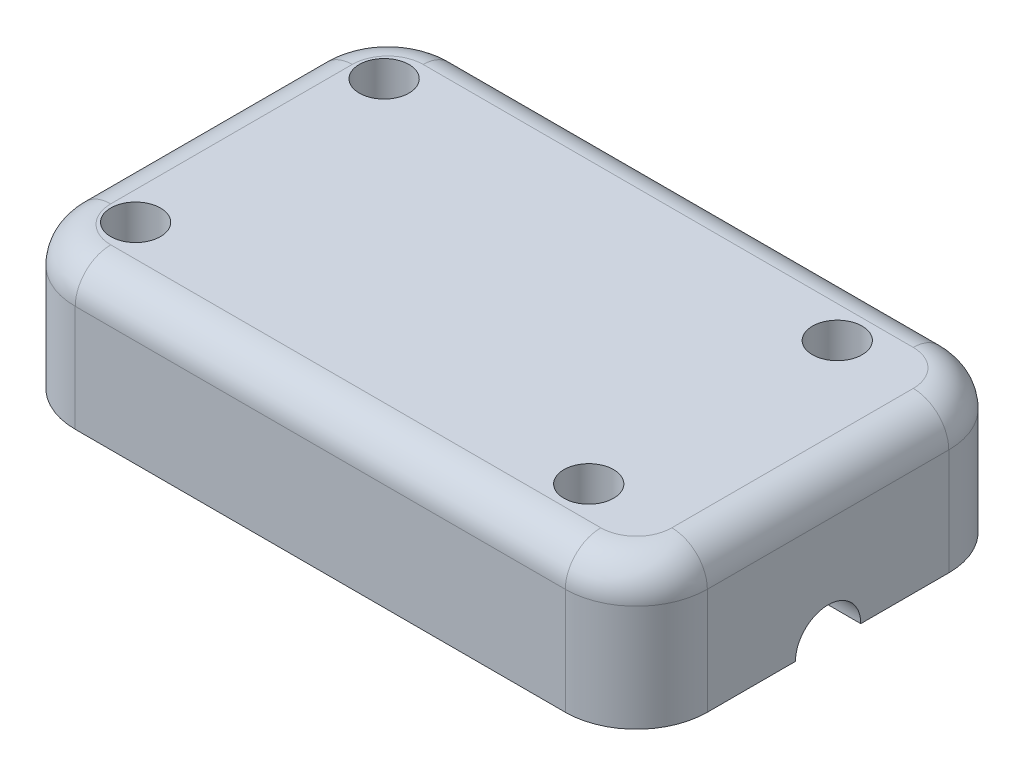
from build123d import *

# Parameters (mm, degrees)
BOSS_EXTRUDE1_DEPTH  = 5
SKETCH3_W            = 89.015633911
SKETCH3_H            = 54
SKETCH3_R            = 1.75
BOSS_EXTRUDE2_DEPTH  = 10
SKETCH4_W            = 5
SKETCH4_H            = 20
SKETCH4_W_2          = 84.015633911
BOSS_EXTRUDE3_DEPTH  = 5
SKETCH5_W            = 84.015633911
SKETCH5_H            = 20
SKETCH5_W_2          = 5
BOSS_EXTRUDE4_DEPTH  = 5
SKETCH6_W            = 5
SKETCH6_H            = 20
BOSS_EXTRUDE5_DEPTH  = 5
SKETCH7_W            = 5
SKETCH7_H            = 20
BOSS_EXTRUDE6_DEPTH  = 5
SKETCH8_W            = 5
SKETCH8_H            = 44
BOSS_EXTRUDE7_DEPTH  = 20
SKETCH11_W           = 89.015633911
SKETCH11_H           = 54
CUT_EXTRUDE2_DEPTH   = 10
SKETCH12_R           = 1.75
BOSS_EXTRUDE8_DEPTH  = 17.5
SKETCH15_W           = 8
SKETCH15_H           = 3
CUT_EXTRUDE4_DEPTH   = 10
BOSS_EXTRUDE9_DEPTH  = 5
SKETCH18_W           = 41.02
SKETCH18_H           = 19.78
BOSS_EXTRUDE10_DEPTH = 2
SKETCH19_R           = 3.5
SKETCH19_R_2         = 1.75
CUT_EXTRUDE5_DEPTH   = 5
FILLET1_R            = 10
FILLET2_R            = 5
BOSS_EXTRUDE11_DEPTH = 12
SKETCH21_W           = 2.5
SKETCH21_H           = 12
BOSS_EXTRUDE12_DEPTH = 7
CUT_EXTRUDE6_DEPTH   = 3
CHAMFER1_SIZE        = 2


with BuildPart() as part:
    # Sketch1 → Boss-Extrude1 (new body)
    with BuildSketch(Plane(origin=(-2.183009885, 0, 0), x_dir=(0, 0, -1), z_dir=(1, 0, 0))):
        with BuildLine():
            Line((30.202901291, 42.056855501), (30.202901291, 27.775000784))
            Line((30.202901291, 27.775000784), (30.202901291, 26.275000784))
            Line((30.202901291, 26.275000784), (30.202901291, 25.275000784))
            Line((30.202901291, 25.275000784), (46.611342077, 25.275000784))
            ThreePointArc((46.611342077, 25.275000784), (51.211342077, 29.875000784), (55.811342077, 25.275000784))
            Line((55.811342077, 25.275000784), (72.202901291, 25.275000784))
            Line((72.202901291, 25.275000784), (72.202901291, 26.275000784))
            Line((72.202901291, 26.275000784), (72.202901291, 27.775000784))
            Line((72.202901291, 27.775000784), (72.202901291, 43.275000784))
            Line((72.202901291, 43.275000784), (72.202901291, 45.275000784))
            Line((72.202901291, 45.275000784), (30.202901291, 45.275000784))
            Line((30.202901291, 45.275000784), (30.202901291, 42.056855501))
        make_face()
    extrude(amount=BOSS_EXTRUDE1_DEPTH)

    # Sketch3 → Boss-Extrude2 (add)
    with BuildSketch(Plane(origin=(0, 45.275000784, 0), x_dir=(1, 0, 0), z_dir=(0, 1, 0))):
        with Locations((-41.690826841, 51.202901291)):
            Rectangle(SKETCH3_W, SKETCH3_H)
        with Locations(Location((-77.198643796, 33.702901291, 0), (0, 0, 270))):
            Circle(SKETCH3_R, mode=Mode.SUBTRACT)
        with Locations(Location((-13.383009885, 33.702901291, 0), (0, 0, 270))):
            Circle(SKETCH3_R, mode=Mode.SUBTRACT)
        with Locations(Location((-77.198643796, 68.702901291, 0), (0, 0, 270))):
            Circle(SKETCH3_R, mode=Mode.SUBTRACT)
        with Locations(Location((-13.383009885, 68.702901291, 0), (0, 0, 270))):
            Circle(SKETCH3_R, mode=Mode.SUBTRACT)
    extrude(amount=BOSS_EXTRUDE2_DEPTH)

    # Sketch4 → Boss-Extrude3 (add)
    with BuildSketch(Plane.XY.offset(-24.202901291)):
        with Locations((0.316990115, 35.275000784)):
            Rectangle(SKETCH4_W, SKETCH4_H)
        with Locations((-44.190826841, 35.275000784)):
            Rectangle(SKETCH4_W_2, SKETCH4_H)
    extrude(amount=-BOSS_EXTRUDE3_DEPTH)

    # Sketch5 → Boss-Extrude4 (add)
    with BuildSketch(Plane(origin=(0, 0, -78.202901291), x_dir=(-1, 0, 0), z_dir=(0, 0, -1))):
        with Locations((44.190826841, 35.275000784)):
            Rectangle(SKETCH5_W, SKETCH5_H)
        with Locations((-0.316990115, 35.275000784)):
            Rectangle(SKETCH5_W_2, SKETCH5_H)
    extrude(amount=-BOSS_EXTRUDE4_DEPTH)

    # Sketch6 → Boss-Extrude5 (add)
    with BuildSketch(Plane(origin=(0, 0, -72.202901291), x_dir=(-1, 0, 0), z_dir=(0, 0, -1))):
        with Locations((-0.316990115, 35.275000784)):
            Rectangle(SKETCH6_W, SKETCH6_H)
    extrude(amount=BOSS_EXTRUDE5_DEPTH)

    # Sketch7 → Boss-Extrude6 (add)
    with BuildSketch(Plane.XY.offset(-30.202901291)):
        with Locations((0.316990115, 35.275000784)):
            Rectangle(SKETCH7_W, SKETCH7_H)
    extrude(amount=BOSS_EXTRUDE6_DEPTH)

    # Sketch8 → Boss-Extrude7 (add)
    with BuildSketch(Plane.XZ.offset(-45.275000784)):
        with Locations((-83.698643796, -51.202901291)):
            Rectangle(SKETCH8_W, SKETCH8_H)
    extrude(amount=BOSS_EXTRUDE7_DEPTH)

    # Sketch11 → Cut-Extrude2 (cut)
    with BuildSketch(Plane(origin=(0, 55.275000784, 0), x_dir=(1, 0, 0), z_dir=(0, 1, 0))):
        with Locations((-41.690826841, 51.202901291)):
            Rectangle(SKETCH11_W, SKETCH11_H)
    extrude(amount=-CUT_EXTRUDE2_DEPTH, mode=Mode.SUBTRACT)

    # Sketch12 → Boss-Extrude8 (add)
    # profile 1 of 4: a face of its own
    with BuildSketch(Plane(origin=(0, 45.275000784, 0), x_dir=(1, 0, 0), z_dir=(0, 1, 0))):
        with BuildLine():
            ThreePointArc((-71.098643796, 33.702901291), (-74.667833649, 39.253126511), (-81.198643796, 38.308332867))
            Line((-81.198643796, 38.308332867), (-81.198643796, 29.202901291))
            Line((-81.198643796, 29.202901291), (-73.08039174, 29.202901291))
            ThreePointArc((-73.08039174, 29.202901291), (-71.616021762, 31.244379127), (-71.098643796, 33.702901291))
        make_face()
        with Locations(Location((-77.198643796, 33.702901291, 0), (0, 0, 270))):
            Circle(SKETCH12_R, mode=Mode.SUBTRACT)
    # profile 2 of 4: a face of its own
    with BuildSketch(Plane(origin=(0, 45.275000784, 0), x_dir=(1, 0, 0), z_dir=(0, 1, 0))):
        with BuildLine():
            ThreePointArc((-71.098643796, 68.702901291), (-71.616021762, 71.161423454), (-73.08039174, 73.202901291))
            Line((-73.08039174, 73.202901291), (-81.198643796, 73.202901291))
            Line((-81.198643796, 73.202901291), (-81.198643796, 64.097469715))
            ThreePointArc((-81.198643796, 64.097469715), (-74.667833649, 63.15267607), (-71.098643796, 68.702901291))
        make_face()
        with Locations(Location((-77.198643796, 68.702901291, 0), (0, 0, 270))):
            Circle(SKETCH12_R, mode=Mode.SUBTRACT)
    # profile 3 of 4: a face of its own
    with BuildSketch(Plane(origin=(0, 45.275000784, 0), x_dir=(1, 0, 0), z_dir=(0, 1, 0))):
        with BuildLine():
            ThreePointArc((-7.283009885, 33.702901291), (-15.841532049, 39.285523325), (-17.501261942, 29.202901291))
            Line((-17.501261942, 29.202901291), (-9.264757829, 29.202901291))
            ThreePointArc((-9.264757829, 29.202901291), (-7.800387851, 31.244379127), (-7.283009885, 33.702901291))
        make_face()
        with Locations(Location((-13.383009885, 33.702901291, 0), (0, 0, 270))):
            Circle(SKETCH12_R, mode=Mode.SUBTRACT)
    # profile 4 of 4: a face of its own
    with BuildSketch(Plane(origin=(0, 45.275000784, 0), x_dir=(1, 0, 0), z_dir=(0, 1, 0))):
        with BuildLine():
            ThreePointArc((-17.501261942, 73.202901291), (-15.841532049, 63.120279257), (-7.283009885, 68.702901291))
            ThreePointArc((-7.283009885, 68.702901291), (-7.800387851, 71.161423454), (-9.264757829, 73.202901291))
            Line((-9.264757829, 73.202901291), (-17.501261942, 73.202901291))
        make_face()
        with Locations(Location((-13.383009885, 68.702901291, 0), (0, 0, 270))):
            Circle(SKETCH12_R, mode=Mode.SUBTRACT)
    extrude(amount=-BOSS_EXTRUDE8_DEPTH)

    # Sketch15 → Cut-Extrude4 (cut)
    with BuildSketch(Plane.ZY.offset(86.198643796)):
        with Locations((-51.202901291, 26.775000784)):
            Rectangle(SKETCH15_W, SKETCH15_H)
    extrude(amount=-CUT_EXTRUDE4_DEPTH, mode=Mode.SUBTRACT)

    # Sketch17 → Boss-Extrude9 (add)
    with BuildSketch(Plane(origin=(0, 45.275000784, 0), x_dir=(1, 0, 0), z_dir=(0, 1, 0))):
        with BuildLine():
            Line((-40.178643796, 40.422901291), (-74.198643796, 40.422901291))
            Line((-74.198643796, 40.422901291), (-81.198643796, 40.422901291))
            Line((-81.198643796, 40.422901291), (-81.198643796, 38.308332867))
            ThreePointArc((-81.198643796, 38.308332867), (-72.64554409, 37.762369614), (-73.08039174, 29.202901291))
            Line((-73.08039174, 29.202901291), (-17.501261942, 29.202901291))
            ThreePointArc((-17.501261942, 29.202901291), (-13.383009885, 39.802901291), (-9.264757829, 29.202901291))
            Line((-9.264757829, 29.202901291), (-2.183009885, 29.202901291))
            Line((-2.183009885, 29.202901291), (-2.183009885, 73.202901291))
            Line((-2.183009885, 73.202901291), (-9.264757829, 73.202901291))
            ThreePointArc((-9.264757829, 73.202901291), (-13.383009885, 62.602901291), (-17.501261942, 73.202901291))
            Line((-17.501261942, 73.202901291), (-73.08039174, 73.202901291))
            ThreePointArc((-73.08039174, 73.202901291), (-72.64554409, 64.643432968), (-81.198643796, 64.097469715))
            Line((-81.198643796, 64.097469715), (-81.198643796, 60.202901291))
            Line((-81.198643796, 60.202901291), (-74.198643796, 60.202901291))
            Line((-74.198643796, 60.202901291), (-40.178643796, 60.202901291))
            Line((-40.178643796, 60.202901291), (-40.178643796, 40.422901291))
        make_face()
    extrude(amount=-BOSS_EXTRUDE9_DEPTH)

    # Sketch18 → Boss-Extrude10 (add)
    with BuildSketch(Plane(origin=(0, 45.275000784, 0), x_dir=(1, 0, 0), z_dir=(0, 1, 0))):
        with Locations((-60.688643796, 50.312901291)):
            Rectangle(SKETCH18_W, SKETCH18_H)
    extrude(amount=-BOSS_EXTRUDE10_DEPTH)

    # Sketch19 → Cut-Extrude5 (cut)
    # profile 1 of 4: a face of its own
    with BuildSketch(Plane(origin=(0, 45.275000784, 0), x_dir=(1, 0, 0), z_dir=(0, 1, 0))):
        with Locations(Location((-77.198643796, 68.702901291, 0), (0, 0, 270))):
            Circle(SKETCH19_R)
        with Locations(Location((-77.198643796, 68.702901291, 0), (0, 0, 270))):
            Circle(SKETCH19_R_2, mode=Mode.SUBTRACT)
    # profile 2 of 4: a face of its own
    with BuildSketch(Plane(origin=(0, 45.275000784, 0), x_dir=(1, 0, 0), z_dir=(0, 1, 0))):
        with Locations(Location((-77.198643796, 33.702901291, 0), (0, 0, 270))):
            Circle(SKETCH19_R)
        with Locations(Location((-77.198643796, 33.702901291, 0), (0, 0, 270))):
            Circle(SKETCH19_R_2, mode=Mode.SUBTRACT)
    # profile 3 of 4: a face of its own
    with BuildSketch(Plane(origin=(0, 45.275000784, 0), x_dir=(1, 0, 0), z_dir=(0, 1, 0))):
        with Locations(Location((-13.383009885, 68.702901291, 0), (0, 0, 270))):
            Circle(SKETCH19_R)
        with Locations(Location((-13.383009885, 68.702901291, 0), (0, 0, 270))):
            Circle(SKETCH19_R_2, mode=Mode.SUBTRACT)
    # profile 4 of 4: a face of its own
    with BuildSketch(Plane(origin=(0, 45.275000784, 0), x_dir=(1, 0, 0), z_dir=(0, 1, 0))):
        with Locations(Location((-13.383009885, 33.702901291, 0), (0, 0, 270))):
            Circle(SKETCH19_R)
        with Locations(Location((-13.383009885, 33.702901291, 0), (0, 0, 270))):
            Circle(SKETCH19_R_2, mode=Mode.SUBTRACT)
    extrude(amount=-CUT_EXTRUDE5_DEPTH, mode=Mode.SUBTRACT)

    # Fillet1
    fillet1_edges = [part.edges().sort_by_distance(p)[0] for p in [
        (-86.198643796, 35.275000784, -78.202901291),
        (-86.198643796, 35.275000784, -24.202901291),
        (2.816990115, 35.275000784, -78.202901291),
        (2.816990115, 35.275000784, -24.202901291),
    ]]
    fillet(fillet1_edges, radius=FILLET1_R)

    # Fillet2
    fillet2_edges = [part.edges().sort_by_distance(p)[0] for p in [
        (-41.690826841, 45.275000784, -24.202901291),
        (-86.198643796, 45.275000784, -51.202901291),
        (2.816990115, 45.275000784, -51.202901291),
        (-41.690826841, 45.275000784, -78.202901291),
        (-83.269711608, 45.275000784, -75.273969103),
        (-0.111942073, 45.275000784, -75.273969103),
        (-0.111942073, 45.275000784, -27.131833479),
        (-83.269711608, 45.275000784, -27.131833479),
    ]]
    fillet(fillet2_edges, radius=FILLET2_R)

    # Sketch20 → Boss-Extrude11 (add)
    with BuildSketch(Plane.XZ.offset(-40.275000784)):
        Polygon((-4.683009885, -45.202901291), (-2.183009885, -45.202901291), (-2.183009885, -43.202901291), (-6.683009885, -43.202901291), (-6.683009885, -59.202901291), (-2.183009885, -59.202901291), (-2.183009885, -57.202901291), (-4.683009885, -57.202901291), align=None)
    extrude(amount=BOSS_EXTRUDE11_DEPTH)

    # Sketch22 → Cut-Extrude6 (cut)
    with BuildSketch(Plane.XZ.offset(-40.275000784)):
        Polygon((-13.383009885, -62.602901291), (-6.683009885, -62.602901291), (-6.683009885, -59.202901291), (-6.683009885, -43.202901291), (-26.574347223, -43.202901291), (-26.574347223, -62.602901291), align=None)
    extrude(amount=-CUT_EXTRUDE6_DEPTH, mode=Mode.SUBTRACT)

    # Chamfer1
    chamfer1_edges = [part.edges().sort_by_distance(p)[0] for p in [
        (-81.198643796, 28.275000784, -51.202901291),
    ]]
    chamfer(chamfer1_edges, length=CHAMFER1_SIZE)


with BuildPart() as body_2:
    # Sketch21 → Boss-Extrude12 (new body)
    with BuildSketch(Plane.XZ.offset(-40.275000784)):
        with Locations((-3.433009885, -51.202901291)):
            Rectangle(SKETCH21_W, SKETCH21_H)
    extrude(amount=BOSS_EXTRUDE12_DEPTH)


solid = Compound([part.part, body_2.part])
